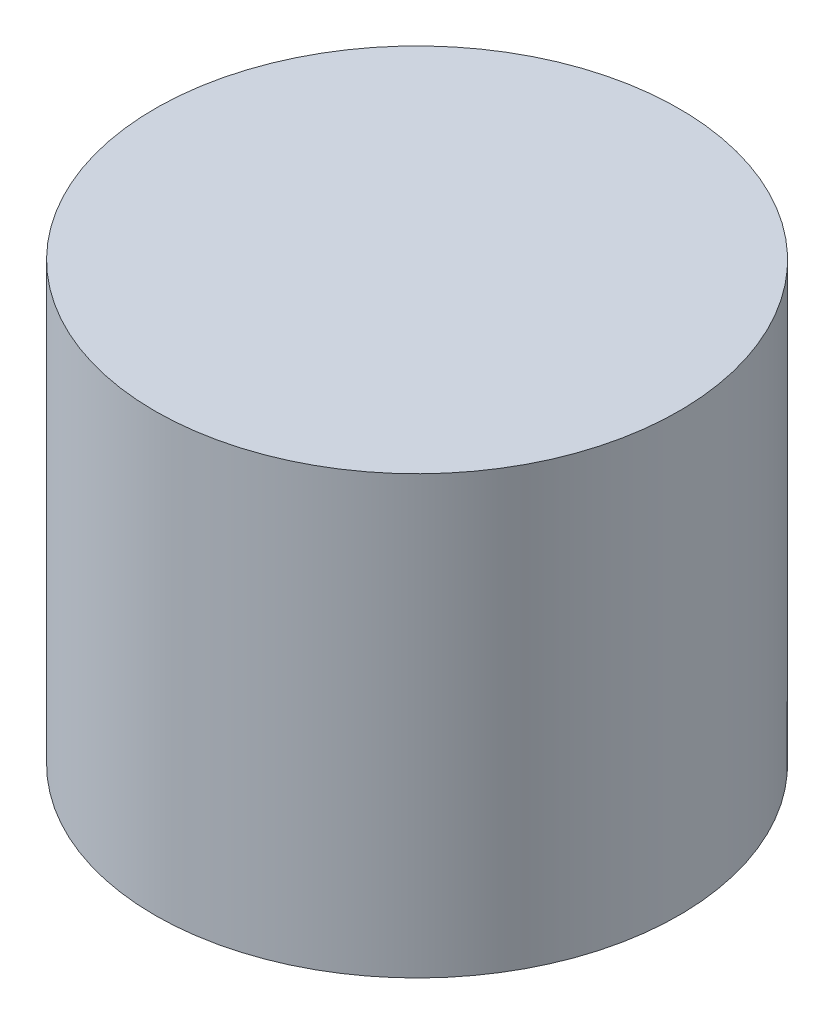
from build123d import *

# Parameters (mm, degrees)
SKETCH1_R           = 6
BOSS_EXTRUDE1_DEPTH = 10
SKETCH2_R           = 1
CUT_EXTRUDE1_DEPTH  = 2


with BuildPart() as part:
    # Sketch1 → Boss-Extrude1 (new body)
    with BuildSketch(Plane(origin=(0, 0, 0), x_dir=(1, 0, 0), z_dir=(0, 1, 0))):
        with Locations(Location((0, 0, 0), (0, 0, 270))):
            Circle(SKETCH1_R)
    extrude(amount=BOSS_EXTRUDE1_DEPTH)

    # Sketch2 → Cut-Extrude1 (cut)
    with BuildSketch(Plane.XZ):
        with Locations(Location((0, 0, 0), (0, 0, 270))):
            Circle(SKETCH2_R)
    extrude(amount=-CUT_EXTRUDE1_DEPTH, mode=Mode.SUBTRACT)


solid = part.part
